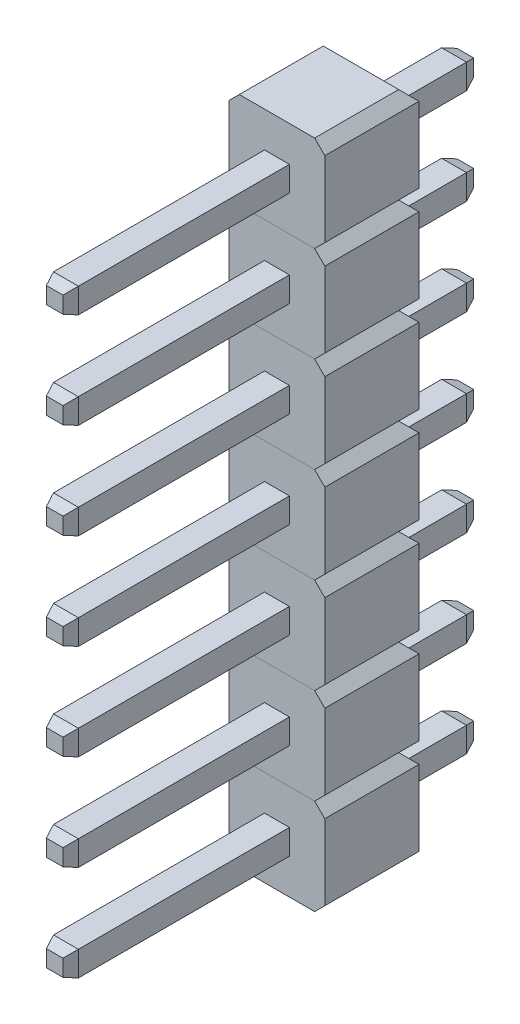
from build123d import *
from OCP.BRepFilletAPI import BRepFilletAPI_MakeChamfer

# Parameters (mm, degrees)
BOSS_EXTRUDE1_DEPTH      = 2.5
CUT_EXTRUDE1_DEPTH       = 4.07827874
CUT_EXTRUDE1_DEPTH_BACK  = 4.07827874
BOSS_EXTRUDE2_DEPTH      = 8.4
BOSS_EXTRUDE2_DEPTH_BACK = 2.5
SKETCH2_W                = 0.66
SKETCH2_H                = 0.66
CHAMFER1_SIZE            = 0.3
CHAMFER1_SIZE2           = 0.10919107
LPATTERN1_COUNT          = 7
LPATTERN1_PITCH          = 2.54


with BuildPart() as part:
    # Sketch1 → Boss-Extrude1 (new body)
    with BuildSketch(Plane.XY):
        Polygon((-1.27, 1), (-1, 1.27), (1, 1.27), (1.27, 1), (1.27, -1), (1, -1.27), (-1, -1.27), (-1.27, -1), align=None)
    extrude(amount=BOSS_EXTRUDE1_DEPTH)

    # Sketch4 → Cut-Extrude1 (cut, two sides: drawn at the far end of the back side and taken through both)
    with BuildSketch(Plane(origin=(0, 0, 0), x_dir=(1, 0, 0), z_dir=(0, 1, 0)).offset(-CUT_EXTRUDE1_DEPTH_BACK)):
        Polygon((-1.27, 0), (1.27, 0), (1, -0.27), (-1, -0.27), align=None)
    extrude(amount=CUT_EXTRUDE1_DEPTH + CUT_EXTRUDE1_DEPTH_BACK, mode=Mode.SUBTRACT)

    # Sketch2 → Boss-Extrude2 (add, two sides: drawn at the far end of the back side and taken through both)
    with BuildSketch(Plane.XY.offset(-BOSS_EXTRUDE2_DEPTH_BACK)):
        Rectangle(SKETCH2_W, SKETCH2_H)
    extrude(amount=BOSS_EXTRUDE2_DEPTH + BOSS_EXTRUDE2_DEPTH_BACK)

    # Chamfer1: one chamfer whose edges measure the first distance from different faces: ONE call of the kernel's chamfer builder (chamfer() names one face for all edges)
    chamfer1_edges_1 = [part.edges().sort_by_distance(p)[0] for p in [
        (0.33, 0, -2.5),
    ]]
    chamfer1_side_1 = [part.faces().sort_by_distance(p)[0] for p in [
        (0.33, 0, -1.115),
    ]]
    chamfer1_edges_2 = [part.edges().sort_by_distance(p)[0] for p in [
        (0, 0.33, -2.5),
    ]]
    chamfer1_side_2 = [part.faces().sort_by_distance(p)[0] for p in [
        (0, 0.33, -1.115),
    ]]
    chamfer1_edges_3 = [part.edges().sort_by_distance(p)[0] for p in [
        (-0.33, 0, -2.5),
    ]]
    chamfer1_side_3 = [part.faces().sort_by_distance(p)[0] for p in [
        (-0.33, 0, -1.115),
    ]]
    chamfer1_edges_4 = [part.edges().sort_by_distance(p)[0] for p in [
        (0, -0.33, -2.5),
    ]]
    chamfer1_side_4 = [part.faces().sort_by_distance(p)[0] for p in [
        (0, -0.33, -1.115),
    ]]
    chamfer1_edges_5 = [part.edges().sort_by_distance(p)[0] for p in [
        (0.33, 0, 8.4),
    ]]
    chamfer1_side_5 = [part.faces().sort_by_distance(p)[0] for p in [
        (0.33, 0, 5.45),
    ]]
    chamfer1_edges_6 = [part.edges().sort_by_distance(p)[0] for p in [
        (0, 0.33, 8.4),
    ]]
    chamfer1_side_6 = [part.faces().sort_by_distance(p)[0] for p in [
        (0, 0.33, 5.45),
    ]]
    chamfer1_edges_7 = [part.edges().sort_by_distance(p)[0] for p in [
        (-0.33, 0, 8.4),
    ]]
    chamfer1_side_7 = [part.faces().sort_by_distance(p)[0] for p in [
        (-0.33, 0, 5.45),
    ]]
    chamfer1_edges_8 = [part.edges().sort_by_distance(p)[0] for p in [
        (0, -0.33, 8.4),
    ]]
    chamfer1_side_8 = [part.faces().sort_by_distance(p)[0] for p in [
        (0, -0.33, 5.45),
    ]]
    chamfer1 = BRepFilletAPI_MakeChamfer(part.part.solid().wrapped)
    for e in chamfer1_edges_1:
        chamfer1.Add(CHAMFER1_SIZE, CHAMFER1_SIZE2, e.wrapped, chamfer1_side_1[0].wrapped)  # the first distance lies on this face
    for e in chamfer1_edges_2:
        chamfer1.Add(CHAMFER1_SIZE, CHAMFER1_SIZE2, e.wrapped, chamfer1_side_2[0].wrapped)  # the first distance lies on this face
    for e in chamfer1_edges_3:
        chamfer1.Add(CHAMFER1_SIZE, CHAMFER1_SIZE2, e.wrapped, chamfer1_side_3[0].wrapped)  # the first distance lies on this face
    for e in chamfer1_edges_4:
        chamfer1.Add(CHAMFER1_SIZE, CHAMFER1_SIZE2, e.wrapped, chamfer1_side_4[0].wrapped)  # the first distance lies on this face
    for e in chamfer1_edges_5:
        chamfer1.Add(CHAMFER1_SIZE, CHAMFER1_SIZE2, e.wrapped, chamfer1_side_5[0].wrapped)  # the first distance lies on this face
    for e in chamfer1_edges_6:
        chamfer1.Add(CHAMFER1_SIZE, CHAMFER1_SIZE2, e.wrapped, chamfer1_side_6[0].wrapped)  # the first distance lies on this face
    for e in chamfer1_edges_7:
        chamfer1.Add(CHAMFER1_SIZE, CHAMFER1_SIZE2, e.wrapped, chamfer1_side_7[0].wrapped)  # the first distance lies on this face
    for e in chamfer1_edges_8:
        chamfer1.Add(CHAMFER1_SIZE, CHAMFER1_SIZE2, e.wrapped, chamfer1_side_8[0].wrapped)  # the first distance lies on this face
    add(Compound.cast(chamfer1.Shape()), mode=Mode.REPLACE)


with BuildPart() as lpattern1_1:
    # LPattern1: pattern copy
    add(part.part.moved(Location(Vector(0, 1, 0) * (1 * LPATTERN1_PITCH))))


with BuildPart() as lpattern1_2:
    # LPattern1: pattern copy
    add(part.part.moved(Location(Vector(0, 1, 0) * (2 * LPATTERN1_PITCH))))


with BuildPart() as lpattern1_3:
    # LPattern1: pattern copy
    add(part.part.moved(Location(Vector(0, 1, 0) * (3 * LPATTERN1_PITCH))))


with BuildPart() as lpattern1_4:
    # LPattern1: pattern copy
    add(part.part.moved(Location(Vector(0, 1, 0) * (4 * LPATTERN1_PITCH))))


with BuildPart() as lpattern1_5:
    # LPattern1: pattern copy
    add(part.part.moved(Location(Vector(0, 1, 0) * (5 * LPATTERN1_PITCH))))


with BuildPart() as lpattern1_6:
    # LPattern1: pattern copy
    add(part.part.moved(Location(Vector(0, 1, 0) * (6 * LPATTERN1_PITCH))))


solid = Compound([part.part, lpattern1_1.part, lpattern1_2.part, lpattern1_3.part, lpattern1_4.part, lpattern1_5.part, lpattern1_6.part])
